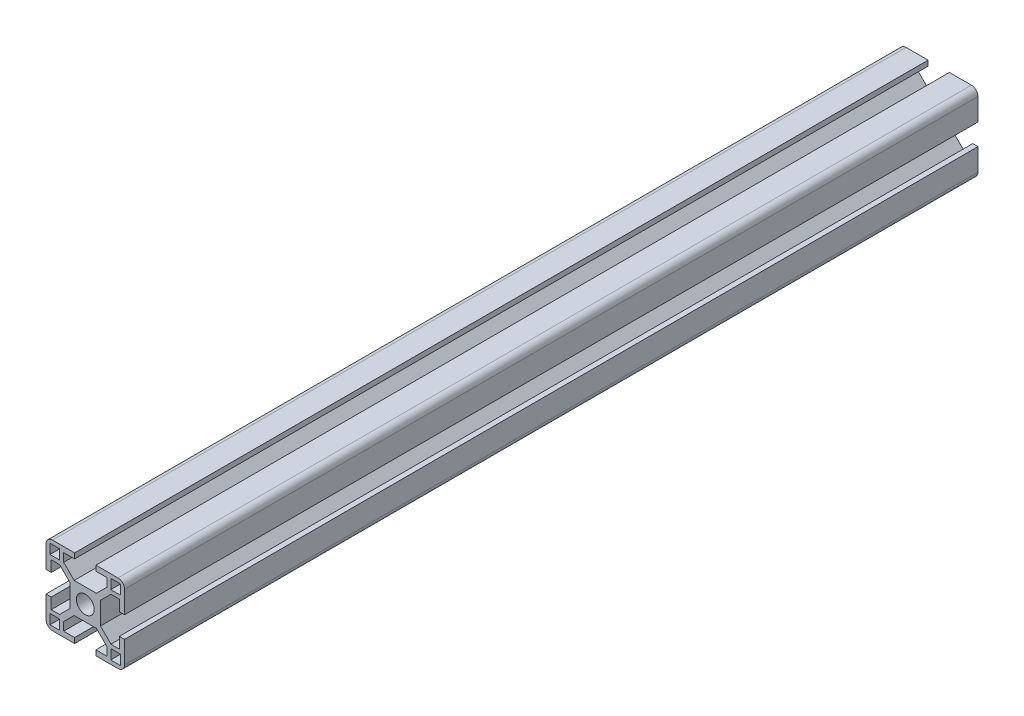
from build123d import *

# Parameters (mm, degrees)
SKETCH11_R                          = 3.4
SKETCH11_W                          = 3.75
SKETCH11_H                          = 3.75
F_3030_3030_PROFILE_ZYLTECH_1_DEPTH = 325.999796


with BuildPart() as part:
    # Sketch11 → 3030 3030 PROFILE ZYLTECH(1) (new body)
    with BuildSketch(Plane(origin=(0, 0, 162.999898), x_dir=(1, 0, 0), z_dir=(0, 0, -1))):
        with BuildLine():
            Line((-9.805634919, -8.25), (-5.8, -4.244365081))
            Line((-5.8, -4.244365081), (-5.8, 4.244365081))
            Line((-5.8, 4.244365081), (-9.805634919, 8.25))
            Line((-9.805634919, 8.25), (-13, 8.25))
            Line((-13, 8.25), (-13, 4.07))
            Line((-13, 4.07), (-15, 4.07))
            Line((-15, 4.07), (-15, 12.5))
            ThreePointArc((-15, 12.5), (-14.267766953, 14.267766953), (-12.5, 15))
            Line((-12.5, 15), (-4.07, 15))
            Line((-4.07, 15), (-4.07, 13))
            Line((-4.07, 13), (-8.25, 13))
            Line((-8.25, 13), (-8.25, 9.805634919))
            Line((-8.25, 9.805634919), (-4.244365081, 5.8))
            Line((-4.244365081, 5.8), (4.244365081, 5.8))
            Line((4.244365081, 5.8), (8.25, 9.805634919))
            Line((8.25, 9.805634919), (8.25, 13))
            Line((8.25, 13), (4.07, 13))
            Line((4.07, 13), (4.07, 15))
            Line((4.07, 15), (12.5, 15))
            ThreePointArc((12.5, 15), (14.267766953, 14.267766953), (15, 12.5))
            Line((15, 12.5), (15, 4.07))
            Line((15, 4.07), (13, 4.07))
            Line((13, 4.07), (13, 8.25))
            Line((13, 8.25), (9.805634919, 8.25))
            Line((9.805634919, 8.25), (5.8, 4.244365081))
            Line((5.8, 4.244365081), (5.8, -4.244365081))
            Line((5.8, -4.244365081), (9.805634919, -8.25))
            Line((9.805634919, -8.25), (13, -8.25))
            Line((13, -8.25), (13, -4.07))
            Line((13, -4.07), (15, -4.07))
            Line((15, -4.07), (15, -12.5))
            ThreePointArc((15, -12.5), (14.267766953, -14.267766953), (12.5, -15))
            Line((12.5, -15), (4.07, -15))
            Line((4.07, -15), (4.07, -13))
            Line((4.07, -13), (8.25, -13))
            Line((8.25, -13), (8.25, -9.805634919))
            Line((8.25, -9.805634919), (4.244365081, -5.8))
            Line((4.244365081, -5.8), (-4.244365081, -5.8))
            Line((-4.244365081, -5.8), (-8.25, -9.805634919))
            Line((-8.25, -9.805634919), (-8.25, -13))
            Line((-8.25, -13), (-4.07, -13))
            Line((-4.07, -13), (-4.07, -15))
            Line((-4.07, -15), (-12.5, -15))
            ThreePointArc((-12.5, -15), (-14.267766953, -14.267766953), (-15, -12.5))
            Line((-15, -12.5), (-15, -4.07))
            Line((-15, -4.07), (-13, -4.07))
            Line((-13, -4.07), (-13, -8.25))
            Line((-13, -8.25), (-9.805634919, -8.25))
        make_face()
        Circle(SKETCH11_R, mode=Mode.SUBTRACT)
        with Locations((-11.625, 11.625)):
            Rectangle(SKETCH11_W, SKETCH11_H, mode=Mode.SUBTRACT)
        with Locations((11.625, 11.625)):
            Rectangle(SKETCH11_W, SKETCH11_H, mode=Mode.SUBTRACT)
        with Locations((-11.625, -11.625)):
            Rectangle(SKETCH11_W, SKETCH11_H, mode=Mode.SUBTRACT)
        with Locations((11.625, -11.625)):
            Rectangle(SKETCH11_W, SKETCH11_H, mode=Mode.SUBTRACT)
    extrude(amount=F_3030_3030_PROFILE_ZYLTECH_1_DEPTH)


solid = part.part
